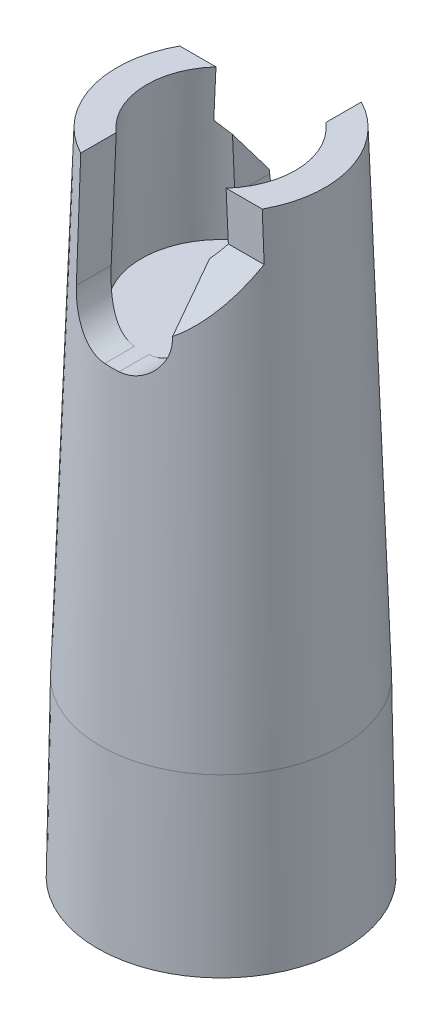
from build123d import *

# Parameters (mm, degrees)
SKETCH1_R                   = 2.9972
INSERT_DEPTH                = 11.811
INSERT_TAPER                = 2
INSERT_OTHER_WAY_DEPTH      = 4.318
INSERT_OTHER_WAY_TAPER      = -1
SKETCH2_R                   = 2.2606
INSERT_BORE_DEPTH           = 13.584955674
INSERT_BORE_TAPER           = 2
INSERT_BORE_OTHER_WAY_DEPTH = 13.584955674
PASS_CUT_DEPTH              = 13.584955674
PASS_CUT_DEPTH_BACK         = 13.584955674
PASS_CHIP_DEPTH             = 13.584955674
CIRPATTERN1_COUNT           = 2
SKETCH5_R                   = 2.032
BOSS_EXTRUDE1_DEPTH         = 1.0922


with BuildPart() as part:
    # Sketch1 → insert (new body)
    with BuildSketch(Plane(origin=(0, 0, 0), x_dir=(1, 0, 0), z_dir=(0, 1, 0))):
        Circle(SKETCH1_R)
    extrude(amount=INSERT_DEPTH, taper=INSERT_TAPER)

    # Sketch1 → insert other way (add)
    with BuildSketch(Plane(origin=(0, 0, 0), x_dir=(1, 0, 0), z_dir=(0, 1, 0))):
        Circle(SKETCH1_R)
    extrude(amount=-INSERT_OTHER_WAY_DEPTH, taper=INSERT_OTHER_WAY_TAPER)

    # Sketch2 → insert bore (cut)
    with BuildSketch(Plane.XZ):
        with Locations(Location((0, 0, 0), (0, 0, 270))):
            Circle(SKETCH2_R)
    extrude(amount=-INSERT_BORE_DEPTH, taper=INSERT_BORE_TAPER, mode=Mode.SUBTRACT)

    # Sketch2 → insert bore other way (cut)
    with BuildSketch(Plane.XZ):
        with Locations(Location((0, 0, 0), (0, 0, 270))):
            Circle(SKETCH2_R)
    extrude(amount=INSERT_BORE_OTHER_WAY_DEPTH, mode=Mode.SUBTRACT)

    # Sketch3 → pass cut (cut, two sides: drawn at the far end of the back side and taken through both)
    with BuildSketch(Plane.XY.offset(-PASS_CUT_DEPTH_BACK)):
        with BuildLine():
            Line((-1.1938, 11.811), (1.1938, 11.811))
            Line((1.1938, 11.811), (1.1938, 9.017))
            ThreePointArc((1.1938, 9.017), (0.89622049, 8.29857951), (0.1778, 8.001))
            Line((0.1778, 8.001), (-0.1778, 8.001))
            ThreePointArc((-0.1778, 8.001), (-0.89622049, 8.29857951), (-1.1938, 9.017))
            Line((-1.1938, 9.017), (-1.1938, 11.811))
        make_face()
    extrude(amount=PASS_CUT_DEPTH + PASS_CUT_DEPTH_BACK, mode=Mode.SUBTRACT)

    # Sketch4 → pass chip (cut, through all)
    with BuildSketch(Plane(origin=(0, 0, 0), x_dir=(0, 0, -1), z_dir=(1, 0, 0))):
        Polygon((1.242429972, 11.811), (2.707189518, 11.811), (2.707189518, 8.703141678), (1.242429972, 10.638716792), align=None)
    pass_chip = extrude(amount=-PASS_CHIP_DEPTH, mode=Mode.SUBTRACT)

    # CirPattern1: pass chip ×2 about axis
    cirpattern1_axis = Axis((0, -4.318, 0), (0, 1, 0))
    for i in range(1, CIRPATTERN1_COUNT):
        add(pass_chip.rotate(cirpattern1_axis, i * 360 / CIRPATTERN1_COUNT), mode=Mode.SUBTRACT)

    # Sketch5 → Boss-Extrude1 (add)
    with BuildSketch(Plane(origin=(0, 8.001, 0), x_dir=(-1, 0, 0), z_dir=(0, -1, 0))):
        Circle(SKETCH5_R)
    extrude(amount=BOSS_EXTRUDE1_DEPTH)


solid = part.part
